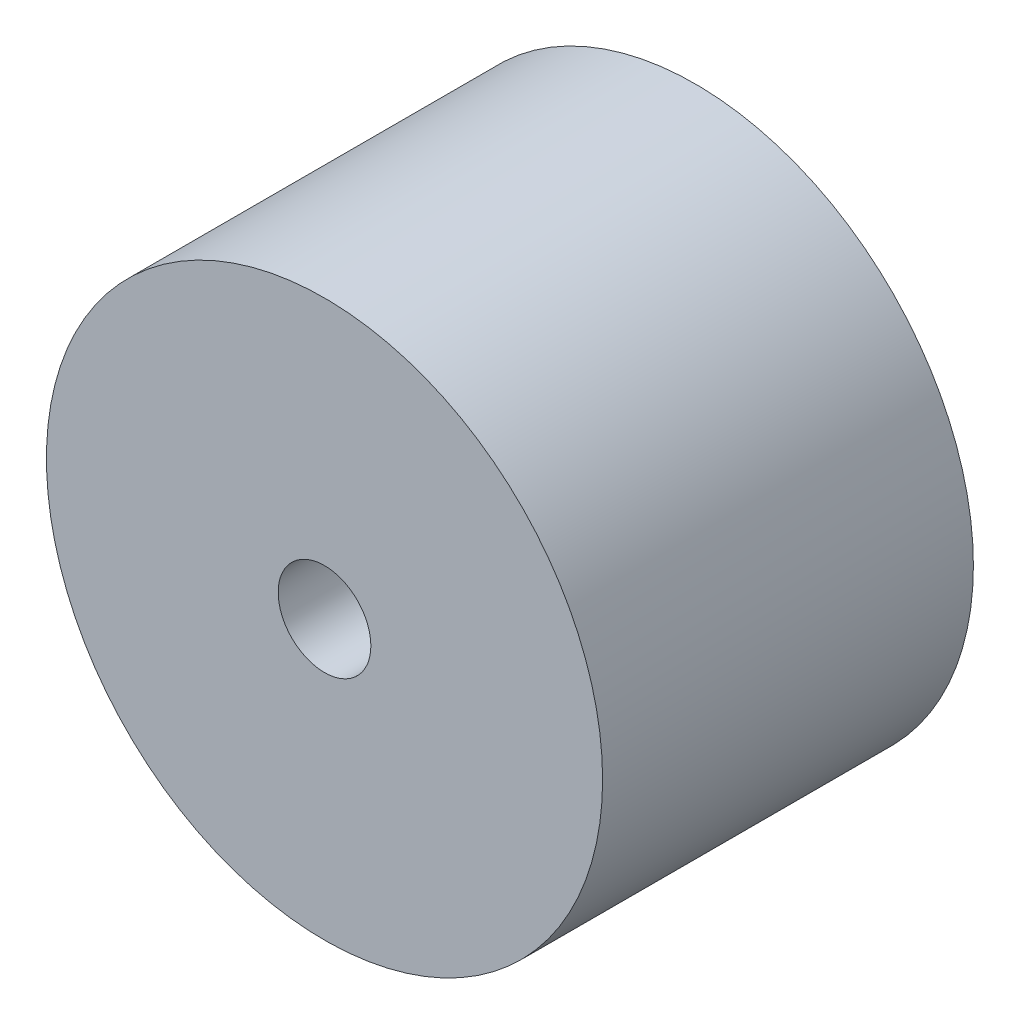
from build123d import *

# Parameters (mm, degrees)
SKETCH1_R           = 30
SKETCH1_R_2         = 5
BOSS_EXTRUDE1_DEPTH = 20


with BuildPart() as part:
    # Sketch1 → Boss-Extrude1 (new, symmetric)
    with BuildSketch(Plane.XY):
        Circle(SKETCH1_R)
        Circle(SKETCH1_R_2, mode=Mode.SUBTRACT)
    extrude(amount=BOSS_EXTRUDE1_DEPTH, both=True)


solid = part.part
